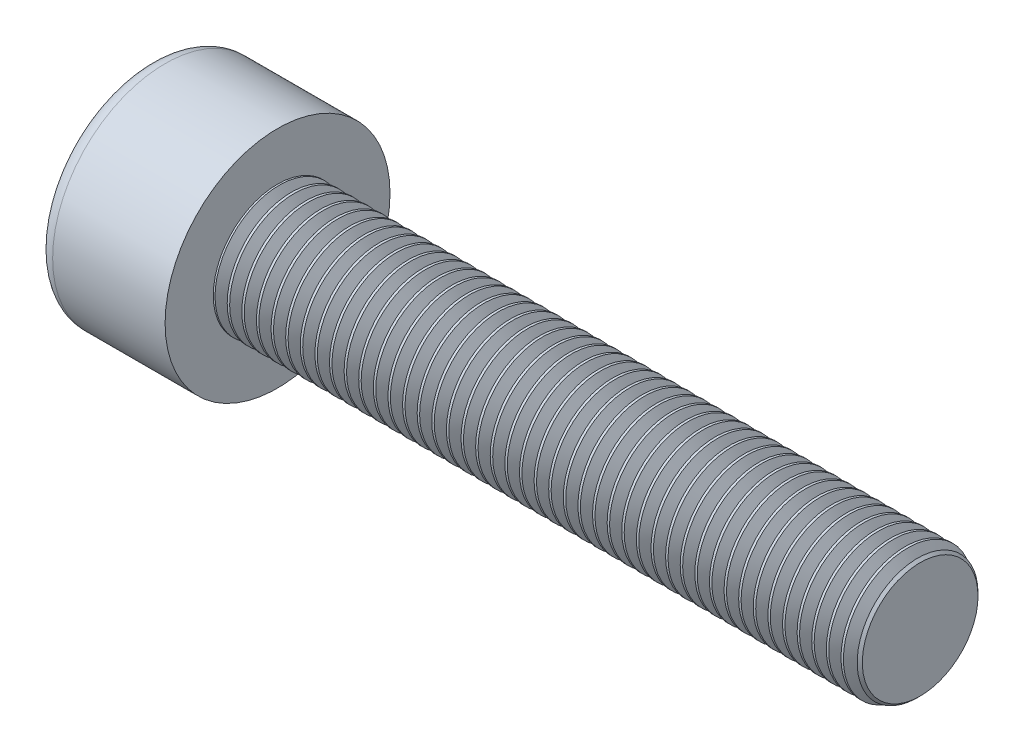
from build123d import *

# Parameters (mm, degrees)
SKETCH1_R           = 3.5
BASEHEAD_DEPTH      = 4
SKETCH2_R           = 2
BASEBODY_DEPTH      = 20
HEXAGONSOCKET_DEPTH = 2
TOPFILLET_R         = 0.5
CHAMFER1_SIZE       = 0.2
LPATTERN10_COUNT    = 44
LPATTERN10_PITCH    = 0.4548


with BuildPart() as part:
    # Sketch1 → BaseHead (new body)
    with BuildSketch(Plane(origin=(0, 0, 0), x_dir=(0, 0, -1), z_dir=(1, 0, 0))):
        Circle(SKETCH1_R)
    extrude(amount=BASEHEAD_DEPTH)

    # Sketch2 → BaseBody (add)
    with BuildSketch(Plane(origin=(4, 0, 0), x_dir=(0, 0, -1), z_dir=(1, 0, 0))):
        Circle(SKETCH2_R)
    extrude(amount=BASEBODY_DEPTH)

    # Sketch3 → HexagonSocket (cut)
    with BuildSketch(Plane(origin=(0, 0, 0), x_dir=(0, 0, -1), z_dir=(1, 0, 0))):
        Polygon((1.732050808, 0), (0.866025404, 1.5), (-0.866025404, 1.5), (-1.732050808, 0), (-0.866025404, -1.5), (0.866025404, -1.5), align=None)
    extrude(amount=HEXAGONSOCKET_DEPTH, mode=Mode.SUBTRACT)

    # Sketch4 → Cut-Revolve1 (revolve, cut)
    with BuildSketch(Plane(origin=(-4.19613823, 0.75, 0), x_dir=(-1, 0, 0), z_dir=(0, 0, 1)), mode=Mode.PRIVATE) as cut_revolve1_sk:
        Polygon((-6.19613823, 2.25), (-7.062163633, 0.75), (-6.19613823, 0.75), align=None)
    revolve(cut_revolve1_sk.sketch.rotate(Axis((0.838992387, 0, 0), (-1, 0, 0)), 90), axis=Axis((0.838992387, 0, 0), (-1, 0, 0)), mode=Mode.SUBTRACT)

    # TopFillet
    topfillet_edges = [part.edges().sort_by_distance(p)[0] for p in [
        (0, 0, 3.5),
    ]]
    fillet(topfillet_edges, radius=TOPFILLET_R)

    # Chamfer1
    chamfer1_edges = [part.edges().sort_by_distance(p)[0] for p in [
        (24, 0, 2),
    ]]
    chamfer(chamfer1_edges, length=CHAMFER1_SIZE)

    # Sketch5 → Cut-Revolve10 (revolve, cut)
    with BuildSketch(Plane.XY, mode=Mode.PRIVATE) as cut_revolve10_sk:
        Polygon((23.8, 1.671776372), (23.9895, 2), (23.9895, 2.379), (23.6105, 2.379), (23.6105, 2), align=None)
    cut_revolve10 = revolve(cut_revolve10_sk.sketch.rotate(Axis((0, 0, 0), (1, 0, 0)), 90), axis=Axis((0, 0, 0), (1, 0, 0)), mode=Mode.SUBTRACT)

    # LPattern10: Cut-Revolve10 ×44
    with Locations(*[(-i * LPATTERN10_PITCH, 0, 0) for i in range(1, LPATTERN10_COUNT)]):
        add(cut_revolve10, mode=Mode.SUBTRACT)


solid = part.part
